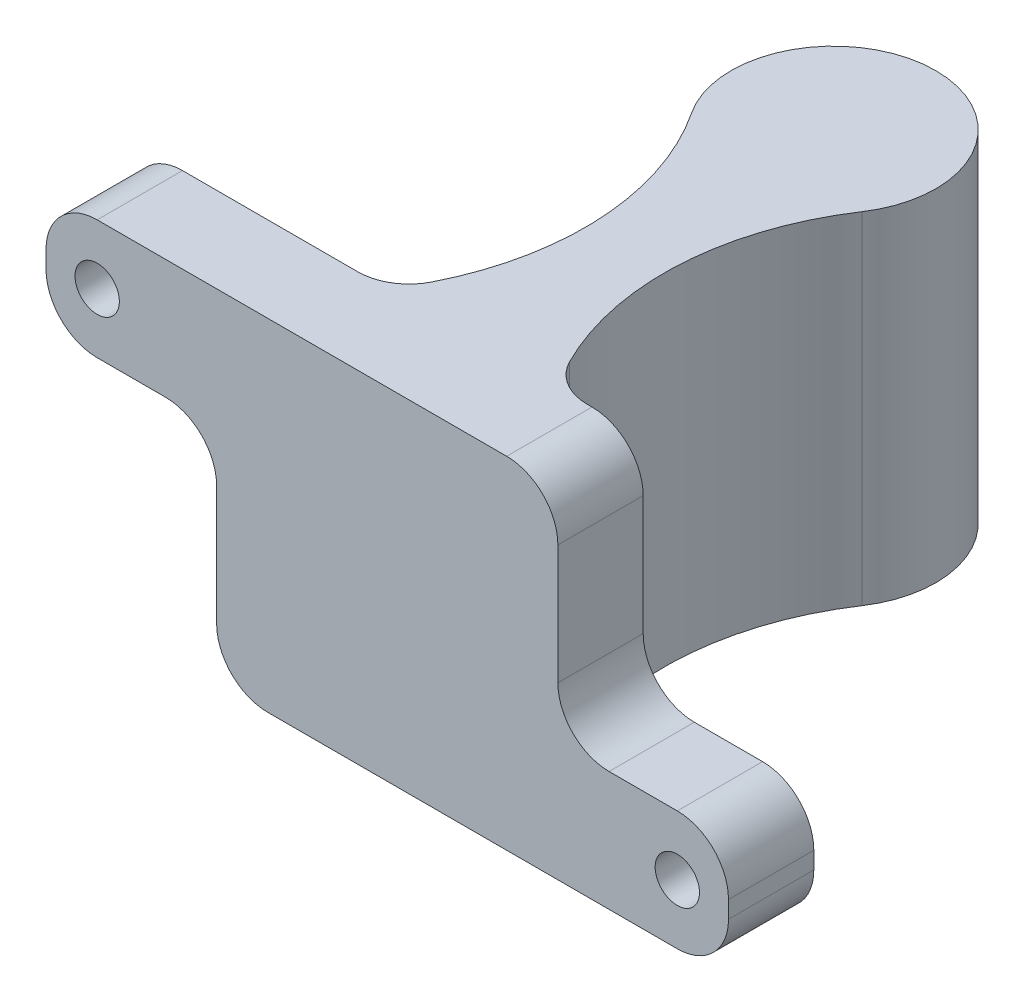
from build123d import *

# Parameters (mm, degrees)
SKETCH1_W           = 20
SKETCH1_H           = 35
SKETCH1_R           = 3.3734375
BOSS_EXTRUDE1_DEPTH = 5
SKETCH2_W           = 20
SKETCH2_H           = 5
BOSS_EXTRUDE2_DEPTH = 20
SKETCH3_R           = 3.3734375
BOSS_EXTRUDE3_DEPTH = 20
SKETCH4_W           = 20
SKETCH4_H           = 35
CUT_EXTRUDE1_DEPTH  = 5
BOSS_EXTRUDE4_START = -3
SKETCH5_R           = 3.3734375
BOSS_EXTRUDE4_DEPTH = 3
SKETCH6_W           = 10
SKETCH6_H           = 7
SKETCH6_R           = 1.3
BOSS_EXTRUDE5_DEPTH = 5
FILLET1_R           = 3


with BuildPart() as part:
    # Sketch1 → Boss-Extrude1 (new body)
    with BuildSketch(Plane(origin=(0, 0, 0), x_dir=(1, 0, 0), z_dir=(0, 1, 0))):
        with Locations((10, 17.5)):
            Rectangle(SKETCH1_W, SKETCH1_H)
        with Locations(Location((10, 26.15, 0), (0, 0, 270))):
            Circle(SKETCH1_R, mode=Mode.SUBTRACT)
    extrude(amount=BOSS_EXTRUDE1_DEPTH)

    # Sketch2 → Boss-Extrude2 (add)
    with BuildSketch(Plane(origin=(0, 5, 0), x_dir=(1, 0, 0), z_dir=(0, 1, 0))):
        with Locations((10, 2.5)):
            Rectangle(SKETCH2_W, SKETCH2_H)
    extrude(amount=BOSS_EXTRUDE2_DEPTH)

    # Sketch3 → Boss-Extrude3 (add)
    with BuildSketch(Plane(origin=(0, 5, 0), x_dir=(1, 0, 0), z_dir=(0, 1, 0))):
        with BuildLine():
            Line((5, 5), (15, 5))
            ThreePointArc((15, 5), (12.311517531, 13.916687605), (15, 22.83337521))
            ThreePointArc((15, 22.83337521), (10, 32.15), (5, 22.83337521))
            ThreePointArc((5, 22.83337521), (7.688482469, 13.916687605), (5, 5))
        make_face()
        with Locations(Location((10, 26.15, 0), (0, 0, 270))):
            Circle(SKETCH3_R, mode=Mode.SUBTRACT)
    extrude(amount=BOSS_EXTRUDE3_DEPTH)

    # Sketch4 → Cut-Extrude1 (cut)
    with BuildSketch(Plane.XZ):
        with Locations((10, -17.5)):
            Rectangle(SKETCH4_W, SKETCH4_H)
    extrude(amount=-CUT_EXTRUDE1_DEPTH, mode=Mode.SUBTRACT)

    # Sketch5 → Boss-Extrude4 (add)
    with BuildSketch(Plane(origin=(0, 25, 0), x_dir=(1, 0, 0), z_dir=(0, 1, 0)).offset(BOSS_EXTRUDE4_START)):
        with Locations(Location((10, 26.15, 0), (0, 0, 90))):
            Circle(SKETCH5_R)
    extrude(amount=BOSS_EXTRUDE4_DEPTH)

    # Sketch6 → Boss-Extrude5 (add)
    # profile 1 of 2: a face of its own
    with BuildSketch(Plane.XY):
        with Locations((25, 8.5)):
            Rectangle(SKETCH6_W, SKETCH6_H)
        with Locations((27, 8.5)):
            Circle(SKETCH6_R, mode=Mode.SUBTRACT)
    # profile 2 of 2: a face of its own
    with BuildSketch(Plane.XY):
        with Locations((-5, 21.5)):
            Rectangle(SKETCH6_W, SKETCH6_H)
        with Locations((-7, 21.5)):
            Circle(SKETCH6_R, mode=Mode.SUBTRACT)
    extrude(amount=-BOSS_EXTRUDE5_DEPTH)

    # Fillet1
    fillet1_edges = [part.edges().sort_by_distance(p)[0] for p in [
        (20, 25, -2.5),
        (5, 15, -5),
        (15, 15, -5),
        (0, 5, -2.5),
        (30, 5, -2.5),
        (30, 12, -2.5),
        (20, 12, -2.5),
        (-10, 25, -2.5),
        (-10, 18, -2.5),
        (0, 18, -2.5),
    ]]
    fillet(fillet1_edges, radius=FILLET1_R)


solid = part.part
